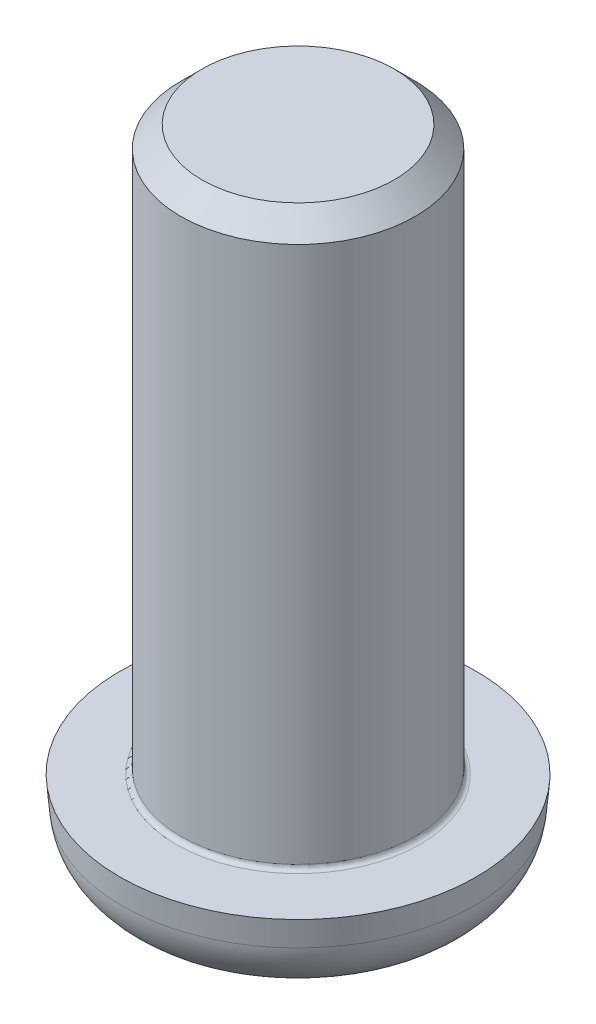
from build123d import *

# Parameters (mm, degrees)
FILLET5_R          = 0.2
CUT_EXTRUDE1_DEPTH = 1.52
CUT_EXTRUDE1_DRAFT = -2
FILLET4_R          = 0.05
CHAMFER1_SIZE      = 0.225


with BuildPart() as part:
    # Sketch1 → Revolve1 (revolve)
    with BuildSketch(Plane(origin=(0, 0, 0), x_dir=(0, 0, -1), z_dir=(1, 0, 0))):
        with BuildLine():
            Line((-1.25, 0), (-1.25, 6))
            Line((-1.25, 6), (0, 6))
            Line((0, 6), (0, -0.8))
            Line((0, -0.8), (-1.52, -0.8))
            ThreePointArc((-1.52, -0.8), (-1.765861533, -0.586564042), (-1.875503174, -0.28))
            Line((-1.875503174, -0.28), (-1.9, 0))
            Line((-1.9, 0), (-1.25, 0))
        make_face()
    revolve(axis=Axis((0, 6, 0), (0, -1, 0)))

    # Fillet5
    fillet5_edges = [part.edges().sort_by_distance(p)[0] for p in [
        (0, -0.8, -1.52),
    ]]
    fillet(fillet5_edges, radius=FILLET5_R)


with BuildPart() as cut_extrude1_tool:
    # Sketch2 → Cut-Extrude1 (with draft: the straight prism first)
    with BuildSketch(Plane.XZ.offset(0.8)):
        Polygon((0.1785, 0.1785), (0.1785, 1.05), (-0.1785, 1.05), (-0.1785, 0.1785), (-1.05, 0.1785), (-1.05, -0.1785), (-0.1785, -0.1785), (-0.1785, -1.05), (0.1785, -1.05), (0.1785, -0.1785), (1.05, -0.1785), (1.05, 0.1785), align=None)
    extrude(amount=-CUT_EXTRUDE1_DEPTH)
    # Cut-Extrude1: the draft: its side faces are tilted about the plane it starts from
    cut_extrude1_sides = [cut_extrude1_tool.faces().sort_by_distance(p)[0] for p in [
        (0.1785, -0.04, 0.61425),
        (0, -0.04, 1.05),
        (-0.1785, -0.04, 0.61425),
        (-0.61425, -0.04, 0.1785),
        (-1.05, -0.04, 0),
        (-0.61425, -0.04, -0.1785),
        (-0.1785, -0.04, -0.61425),
        (0, -0.04, -1.05),
        (0.1785, -0.04, -0.61425),
        (0.61425, -0.04, -0.1785),
        (1.05, -0.04, 0),
        (0.61425, -0.04, 0.1785),
    ]]
    draft(cut_extrude1_sides, Plane.XZ.offset(0.8), CUT_EXTRUDE1_DRAFT)


with BuildPart() as part_1:
    add(part.part)

    # Cut-Extrude1: cut by cut_extrude1_tool
    add(cut_extrude1_tool.part, mode=Mode.SUBTRACT)

    # Fillet4
    fillet4_edges = [part_1.edges().sort_by_distance(p)[0] for p in [
        (0, 0, -1.25),
    ]]
    fillet(fillet4_edges, radius=FILLET4_R)

    # Chamfer1
    chamfer1_edges = [part_1.edges().sort_by_distance(p)[0] for p in [
        (0, 6, -1.25),
    ]]
    chamfer(chamfer1_edges, length=CHAMFER1_SIZE)


solid = part_1.part
